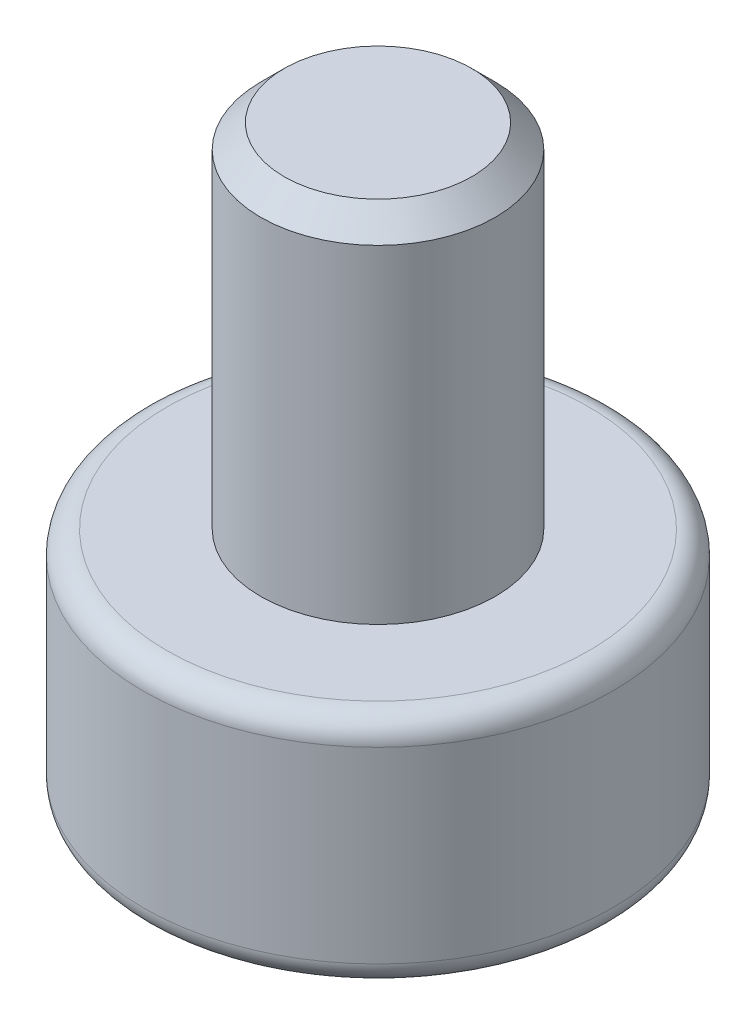
from build123d import *

# Parameters (mm, degrees)
SKETCH_2_R          = 2
EXTRUDE_1_DEPTH     = 2
SKETCH_3_R          = 1
EXTRUDE_2_DEPTH     = 3
FILLET_1_R          = 0.2
SKETCH_4_R          = 0.765
CUT_EXTRUDE_1_DEPTH = 1.52
CHAMFER_1_SIZE      = 0.1
CHAMFER_2_SIZE      = 0.2


with BuildPart() as part:
    # 草图2 → 凸台-拉伸1 (new body)
    with BuildSketch(Plane(origin=(0, 0, 0), x_dir=(1, 0, 0), z_dir=(0, 1, 0))):
        with Locations(Location((0, 0, 0), (0, 0, 270))):
            Circle(SKETCH_2_R)
    extrude(amount=EXTRUDE_1_DEPTH)

    # 草图3 → 凸台-拉伸2 (add)
    with BuildSketch(Plane(origin=(0, 2, 0), x_dir=(1, 0, 0), z_dir=(0, 1, 0))):
        with Locations(Location((0, 0, 0), (0, 0, 270))):
            Circle(SKETCH_3_R)
    extrude(amount=EXTRUDE_2_DEPTH)

    # 圆角1
    fillet_1_edges = [part.edges().sort_by_distance(p)[0] for p in [
        (0, 0, -2),
        (0, 2, -2),
    ]]
    fillet(fillet_1_edges, radius=FILLET_1_R)

    # 草图4 → 切除-拉伸1 (cut)
    with BuildSketch(Plane.XZ):
        with Locations(Location((0, 0, 0), (0, 0, 270))):
            Circle(SKETCH_4_R)
    extrude(amount=-CUT_EXTRUDE_1_DEPTH, mode=Mode.SUBTRACT)

    # 倒角1
    chamfer_1_edges = [part.edges().sort_by_distance(p)[0] for p in [
        (0, 0, 0.765),
    ]]
    chamfer(chamfer_1_edges, length=CHAMFER_1_SIZE)

    # 倒角2
    chamfer_2_edges = [part.edges().sort_by_distance(p)[0] for p in [
        (0, 5, -1),
    ]]
    chamfer(chamfer_2_edges, length=CHAMFER_2_SIZE)


solid = part.part
